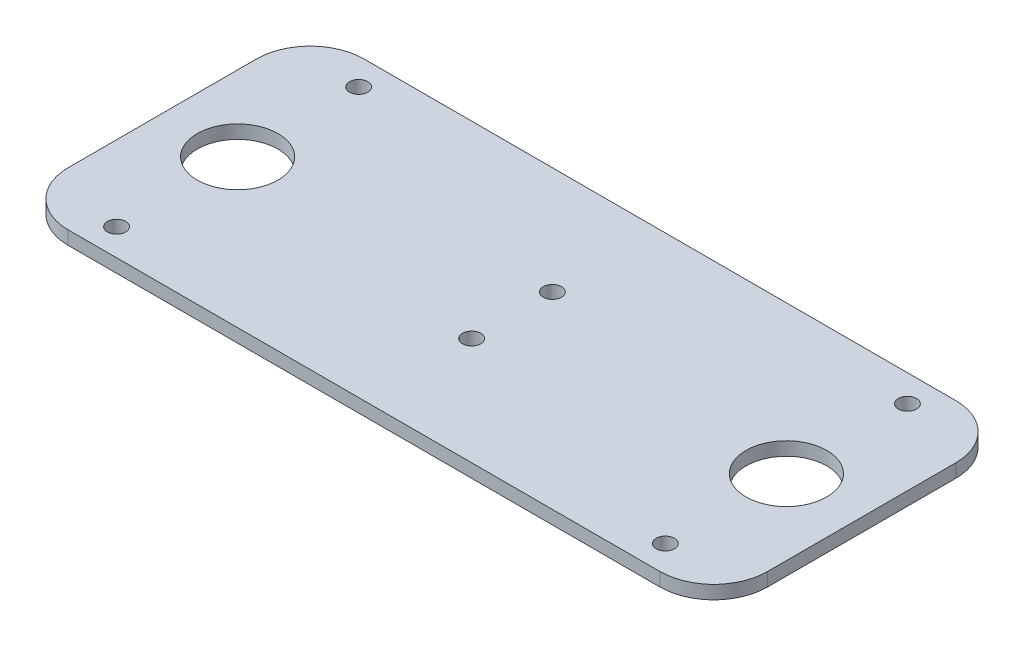
from build123d import *

# Parameters (mm, degrees)
BOSS_EXTRUDE1_DEPTH = 2.5
SKETCH2_R           = 1.7
SKETCH2_R_2         = 7.5
CUT_EXTRUDE1_DEPTH  = 142.178079035


with BuildPart() as part:
    # Sketch1 → Boss-Extrude1 (new body)
    with BuildSketch(Plane(origin=(0, 0, 0), x_dir=(1, 0, 0), z_dir=(0, 1, 0))):
        with BuildLine():
            Line((10, 0), (120, 0))
            ThreePointArc((120, 0), (127.071067812, 2.928932188), (130, 10))
            Line((130, 10), (130, 45))
            ThreePointArc((130, 45), (127.071067812, 52.071067812), (120, 55))
            Line((120, 55), (10, 55))
            ThreePointArc((10, 55), (2.928932188, 52.071067812), (0, 45))
            Line((0, 45), (0, 10))
            ThreePointArc((0, 10), (2.928932188, 2.928932188), (10, 0))
        make_face()
    extrude(amount=BOSS_EXTRUDE1_DEPTH)

    # Sketch2 → Cut-Extrude1 (cut, through all)
    with BuildSketch(Plane(origin=(0, 2.5, 0), x_dir=(1, 0, 0), z_dir=(0, 1, 0))):
        with Locations(Location((14, 5, 0), (0, 0, 270))):
            Circle(SKETCH2_R)
        with Locations(Location((14, 50, 0), (0, 0, 270))):
            Circle(SKETCH2_R)
        with Locations(Location((116, 5, 0), (0, 0, 90))):
            Circle(SKETCH2_R)
        with Locations(Location((116, 50, 0), (0, 0, 90))):
            Circle(SKETCH2_R)
        with Locations(Location((14, 27.5, 0), (0, 0, 270))):
            Circle(SKETCH2_R_2)
        with Locations(Location((116, 27.5, 0), (0, 0, 90))):
            Circle(SKETCH2_R_2)
        with Locations(Location((65, 35, 0), (0, 0, 270))):
            Circle(SKETCH2_R)
        with Locations(Location((65, 20, 0), (0, 0, 90))):
            Circle(SKETCH2_R)
    extrude(amount=-CUT_EXTRUDE1_DEPTH, mode=Mode.SUBTRACT)


solid = part.part
